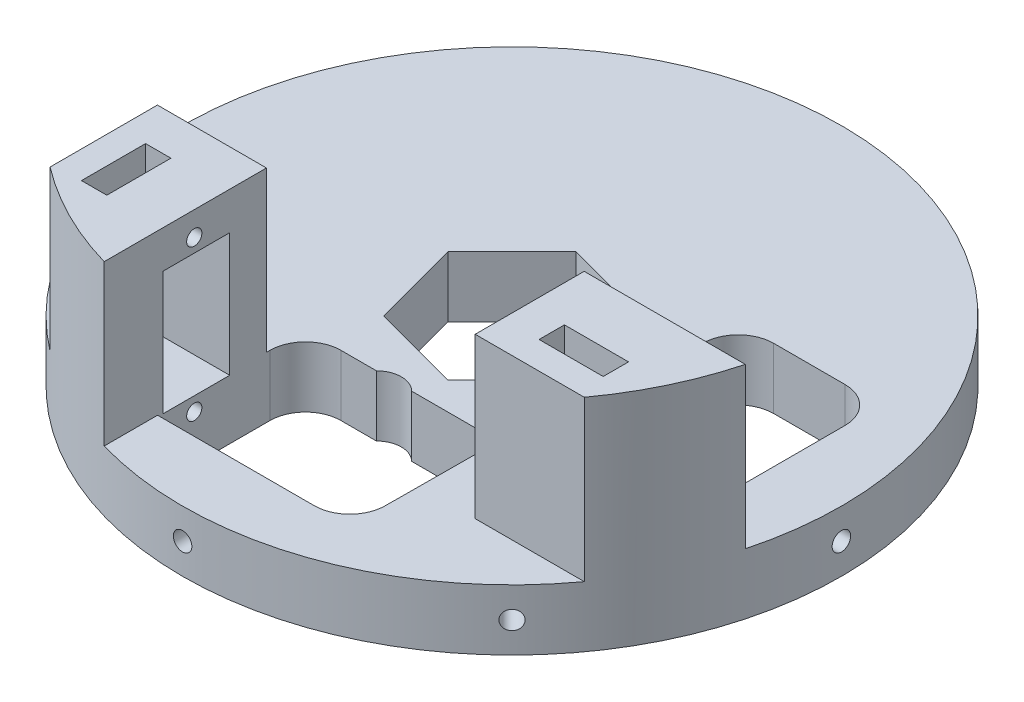
from build123d import *
from build123d.topology import SkipClean

# Parameters (mm, degrees)
BOSS_EXTRUDE1_DEPTH   = 12
BOSS_EXTRUDE1_2_DEPTH = 12
BOSS_EXTRUDE2_DEPTH   = 43.5
SKETCH9_W             = 16.09
SKETCH9_H             = 12.33
BOSS_EXTRUDE3_DEPTH   = 12.5
SKETCH10_W            = 12.33
SKETCH10_H            = 16.09
BOSS_EXTRUDE4_DEPTH   = 12.5
BOSS_EXTRUDE5_START   = 22.85
SKETCH11_W            = 12.33
SKETCH11_H            = 16.09
SKETCH11_W_2          = 16.09
SKETCH11_H_2          = 12.33
BOSS_EXTRUDE5_DEPTH   = 8.15
SKETCH21_W            = 34.892896775
SKETCH21_H            = 3.983406167
SKETCH21_W_2          = 3.397806166
SKETCH21_H_2          = 35.53848689
BOSS_EXTRUDE8_DEPTH   = 12
SKETCH13_W            = 0.82460559
SKETCH13_H            = 22.85
CUT_EXTRUDE1_DEPTH    = 16.09
SKETCH14_W            = 0.915845165
SKETCH14_H            = 22.85
CUT_EXTRUDE2_DEPTH    = 16.09
SKETCH15_W            = 2.3
SKETCH15_H            = 12
BOSS_EXTRUDE6_DEPTH   = 39.09
SKETCH16_W            = 3.5
SKETCH16_H            = 12
BOSS_EXTRUDE7_DEPTH   = 39.09
SKETCH17_W            = 10.950625106
SKETCH17_H            = 21.5
SKETCH17_W_2          = 21.501773634
SKETCH17_H_2          = 11.67953826
CUT_EXTRUDE3_DEPTH    = 31.5
CUT_EXTRUDE4_START    = 65
SKETCH18_R            = 1.825
CUT_EXTRUDE4_DEPTH    = 11
CIRPATTERN1_COUNT     = 8
SKETCH19_R            = 1.5
CUT_EXTRUDE5_DEPTH    = 5
SKETCH20_R            = 1.5
CUT_EXTRUDE8_DEPTH    = 5
SKETCH22_W            = 5
SKETCH22_H            = 12.65
SKETCH22_W_2          = 12.65
SKETCH22_H_2          = 5
CUT_EXTRUDE9_DEPTH    = 12
FILLET1_R             = 7
CUT_EXTRUDE10_DEPTH   = 12
CUT_EXTRUDE11_DEPTH   = 12
SKETCH25_W            = 13.245845165
SKETCH25_H            = 0.617327952
SKETCH25_H_2          = 0.5
CUT_EXTRUDE12_DEPTH   = 16.09
SKETCH26_W            = 13.15460559
SKETCH26_H            = 0.716542238
SKETCH26_H_2          = 0.793164057
CUT_EXTRUDE13_DEPTH   = 16.09


with BuildPart() as part:
    # Sketch8 → Boss-Extrude1 (new body)
    with BuildSketch(Plane(origin=(0, 0, 0), x_dir=(1, 0, 0), z_dir=(0, 1, 0))):
        with BuildLine():
            Line((-39.48619564, -18.776596206), (-17.984422006, -18.776596206))
            Line((-17.984422006, -18.776596206), (-17.984422006, -18.772777241))
            Line((-17.984422006, -18.772777241), (12.857426144, -18.772777241))
            Line((12.857426144, -18.772777241), (20.062824101, -25.857862934))
            Line((20.062824101, -25.857862934), (20.062824101, -16.775))
            Line((20.062824101, -16.775), (25.897828719, -16.775))
            Line((25.897828719, -16.775), (20.099516291, -11.073504999))
            Line((20.099516291, -11.073504999), (20.099516291, 21.123910655))
            Line((20.099516291, 21.123910655), (53.873878262, 21.123910655))
            Line((53.873878262, 21.123910655), (53.873878262, -16.775))
            Line((53.873878262, -16.775), (62.798084167, -16.775))
            ThreePointArc((62.798084167, -16.775), (-20.966872805, 61.525525148), (-39.48619564, -51.63177659))
            Line((-39.48619564, -51.63177659), (-39.48619564, -18.776596206))
        make_face()
        Polygon((12.655697004, 12.655697004), (17.288003611, -4.632306606), (4.632306606, -17.288003611), (-12.655697004, -12.655697004), (-17.288003611, 4.632306606), (-4.632306606, 17.288003611), align=None, mode=Mode.SUBTRACT)
    extrude(amount=BOSS_EXTRUDE1_DEPTH)



with BuildPart() as body_2:
    # Sketch8 → Boss-Extrude1 2 (new body)
    with BuildSketch(Plane(origin=(0, 0, 0), x_dir=(1, 0, 0), z_dir=(0, 1, 0))):
        with BuildLine():
            Line((-17.984422006, -55.432543879), (-17.984422006, -62.462473255))
            ThreePointArc((-17.984422006, -62.462473255), (21.088153384, -61.484061242), (52.535934131, -38.275))
            Line((52.535934131, -38.275), (20.062824101, -38.275))
            Line((20.062824101, -38.275), (20.062824101, -25.857862934))
            Line((20.062824101, -25.857862934), (19.864525542, -55.432543879))
            Line((19.864525542, -55.432543879), (-17.984422006, -55.432543879))
        make_face()
    extrude(amount=BOSS_EXTRUDE1_2_DEPTH)


with BuildPart() as part_1:
    add(part.part)

    add(body_2.part)  # Boss-Extrude2 merges body 2
    # Sketch8<4> → Boss-Extrude2 (add)
    with BuildSketch(Plane(origin=(0, 0, 0), x_dir=(1, 0, 0), z_dir=(0, 1, 0))):
        with BuildLine():
            Line((-34.074422006, -38.525), (-17.984422006, -38.525))
            Line((-17.984422006, -38.525), (-17.984422006, -18.776596206))
            Line((-17.984422006, -18.776596206), (-39.48619564, -18.776596206))
            Line((-39.48619564, -18.776596206), (-39.48619564, -51.63177659))
            ThreePointArc((-39.48619564, -51.63177659), (-29.241134908, -58.051322373), (-17.984422006, -62.462473255))
            Line((-17.984422006, -62.462473255), (-17.984422006, -50.855))
            Line((-17.984422006, -50.855), (-34.074422006, -50.855))
            Line((-34.074422006, -50.855), (-34.074422006, -38.525))
        make_face()
        with BuildLine():
            Line((20.062824101, -16.775), (20.062824101, -38.275))
            Line((20.062824101, -38.275), (52.535934131, -38.275))
            ThreePointArc((52.535934131, -38.275), (58.660433379, -27.999170628), (62.798084167, -16.775))
            Line((62.798084167, -16.775), (50.855, -16.775))
            Line((50.855, -16.775), (50.855, -32.865))
            Line((50.855, -32.865), (38.525, -32.865))
            Line((38.525, -32.865), (38.525, -16.775))
            Line((38.525, -16.775), (20.062824101, -16.775))
        make_face()
    extrude(amount=BOSS_EXTRUDE2_DEPTH)

    # Sketch9 → Boss-Extrude3 (add)
    with BuildSketch(Plane.XZ):
        with Locations((-26.029422006, 44.69)):
            Rectangle(SKETCH9_W, SKETCH9_H)
    extrude(amount=-BOSS_EXTRUDE3_DEPTH)

    # Sketch10 → Boss-Extrude4 (add)
    with BuildSketch(Plane.XZ):
        with Locations((44.69, 24.82)):
            Rectangle(SKETCH10_W, SKETCH10_H)
    extrude(amount=-BOSS_EXTRUDE4_DEPTH)

    # Sketch11 → Boss-Extrude5 (add)
    with BuildSketch(Plane(origin=(0, 12.5, 0), x_dir=(1, 0, 0), z_dir=(0, 1, 0)).offset(BOSS_EXTRUDE5_START)):
        with Locations((44.69, -24.82)):
            Rectangle(SKETCH11_W, SKETCH11_H)
        with Locations((-26.029422006, -44.69)):
            Rectangle(SKETCH11_W_2, SKETCH11_H_2)
    extrude(amount=BOSS_EXTRUDE5_DEPTH)

    # Sketch21 → Boss-Extrude8 (add)
    with BuildSketch(Plane(origin=(0, 12, 0), x_dir=(1, 0, 0), z_dir=(0, 1, 0))):
        with Locations((-0.537973619, -20.764480324)):
            Rectangle(SKETCH21_W, SKETCH21_H)
        with Locations((21.798419374, 3.35466721)):
            Rectangle(SKETCH21_W_2, SKETCH21_H_2)
    extrude(amount=-BOSS_EXTRUDE8_DEPTH)

    # Sketch13 → Cut-Extrude1 (cut)
    with BuildSketch(Plane(origin=(-17.984422006, 0, 0), x_dir=(0, 0, -1), z_dir=(1, 0, 0))):
        with Locations((-38.112697205, 23.925)):
            Rectangle(SKETCH13_W, SKETCH13_H)
    extrude(amount=-CUT_EXTRUDE1_DEPTH, mode=Mode.SUBTRACT)

    # Sketch14 → Cut-Extrude2 (cut)
    with BuildSketch(Plane(origin=(0, 0, 16.775), x_dir=(-1, 0, 0), z_dir=(0, 0, -1))):
        with Locations((-38.067077418, 23.925)):
            Rectangle(SKETCH14_W, SKETCH14_H)
    extrude(amount=-CUT_EXTRUDE2_DEPTH, mode=Mode.SUBTRACT)

    # Sketch15 → Boss-Extrude6 (add)
    with BuildSketch(Plane(origin=(0, 0, 16.775), x_dir=(-1, 0, 0), z_dir=(0, 0, -1))):
        with Locations((-52.723878262, 6)):
            Rectangle(SKETCH15_W, SKETCH15_H)
    extrude(amount=BOSS_EXTRUDE6_DEPTH)

    # Sketch16 → Boss-Extrude7 (add)
    with BuildSketch(Plane(origin=(-17.984422006, 0, 0), x_dir=(0, 0, -1), z_dir=(1, 0, 0))):
        with Locations((-53.682543879, 6)):
            Rectangle(SKETCH16_W, SKETCH16_H)
    extrude(amount=BOSS_EXTRUDE7_DEPTH)

    # Sketch17 → Cut-Extrude3 (cut)
    with BuildSketch(Plane(origin=(0, 43.5, 0), x_dir=(1, 0, 0), z_dir=(0, 1, 0))):
        with Locations((25.538136654, -27.525)):
            Rectangle(SKETCH17_W, SKETCH17_H)
        with Locations((-28.735308823, -24.616365336)):
            Rectangle(SKETCH17_W_2, SKETCH17_H_2)
    extrude(amount=-CUT_EXTRUDE3_DEPTH, mode=Mode.SUBTRACT)

    # Sketch18 → Cut-Extrude4 (cut)
    with SkipClean():  # the faces are left unmerged after this step: merging them gives an invalid solid
        with BuildSketch(Plane.XY.offset(CUT_EXTRUDE4_START)):
            with Locations((0, 6)):
                Circle(SKETCH18_R)
        cut_extrude4 = extrude(amount=-CUT_EXTRUDE4_DEPTH, mode=Mode.SUBTRACT)

    # CirPattern1: Cut-Extrude4 ×8 about axis
    with SkipClean():  # the faces are left unmerged after this step: merging them gives an invalid solid
        cirpattern1_axis = Axis((0, 12, 0), (0, -1, 0))
        for i in range(1, CIRPATTERN1_COUNT):
            add(cut_extrude4.rotate(cirpattern1_axis, i * 360 / CIRPATTERN1_COUNT), mode=Mode.SUBTRACT)

    # Sketch19 → Cut-Extrude5 (cut)
    with SkipClean():  # the faces are left unmerged after this step: merging them gives an invalid solid
        with BuildSketch(Plane(origin=(0, 0, 16.775), x_dir=(-1, 0, 0), z_dir=(0, 0, -1))):
            with Locations((-44.69, 38.75)):
                Circle(SKETCH19_R)
            with Locations((-44.69, 8.95)):
                Circle(SKETCH19_R)
        extrude(amount=-CUT_EXTRUDE5_DEPTH, mode=Mode.SUBTRACT)

    # Sketch20 → Cut-Extrude8 (cut)
    with SkipClean():  # the faces are left unmerged after this step: merging them gives an invalid solid
        with BuildSketch(Plane(origin=(-17.984422006, 0, 0), x_dir=(0, 0, -1), z_dir=(1, 0, 0))):
            with Locations((-44.69, 38.75)):
                Circle(SKETCH20_R)
            with Locations((-44.69, 8.95)):
                Circle(SKETCH20_R)
        extrude(amount=-CUT_EXTRUDE8_DEPTH, mode=Mode.SUBTRACT)

    # Sketch22 → Cut-Extrude9 (cut)
    with SkipClean():  # the faces are left unmerged after this step: merging them gives an invalid solid
        with BuildSketch(Plane(origin=(0, 43.5, 0), x_dir=(1, 0, 0), z_dir=(0, 1, 0))):
            with Locations((-31.574422006, -44.53)):
                Rectangle(SKETCH22_W, SKETCH22_H)
            with Locations((44.53, -30.365)):
                Rectangle(SKETCH22_W_2, SKETCH22_H_2)
        extrude(amount=-CUT_EXTRUDE9_DEPTH, mode=Mode.SUBTRACT)

    # Fillet1
    fillet1_edges = [part_1.edges().sort_by_distance(p)[0] for p in [
        (51.573878262, 6, -21.123910655),
        (19.88799308, 6, 51.932543879),
        (-17.984422006, 6, 22.756183408),
        (23.497322457, 6, -21.123910655),
    ]]
    fillet(fillet1_edges, radius=FILLET1_R)

    # Sketch23 → Cut-Extrude10 (cut)
    with SkipClean():  # the faces are left unmerged after this step: merging them gives an invalid solid
        with BuildSketch(Plane(origin=(0, 12, 0), x_dir=(1, 0, 0), z_dir=(0, 1, 0))):
            with BuildLine():
                Line((-3.988594308, -22.756183408), (2.962026381, -22.756183408))
                ThreePointArc((2.962026381, -22.756183408), (-0.513283963, -21.31666273), (-3.988594308, -22.756183408))
            make_face()
        extrude(amount=-CUT_EXTRUDE10_DEPTH, mode=Mode.SUBTRACT)

    # Sketch24 → Cut-Extrude11 (cut)
    with SkipClean():  # the faces are left unmerged after this step: merging them gives an invalid solid
        with BuildSketch(Plane(origin=(0, 12, 0), x_dir=(1, 0, 0), z_dir=(0, 1, 0))):
            with BuildLine():
                Line((23.497322457, -3.301623153), (23.497322457, 3.156615754))
                ThreePointArc((23.497322457, 3.156615754), (22.159777385, -0.072503699), (23.497322457, -3.301623153))
            make_face()
        extrude(amount=-CUT_EXTRUDE11_DEPTH, mode=Mode.SUBTRACT)

    # Sketch25 → Cut-Extrude12 (cut)
    with SkipClean():  # the faces are left unmerged after this step: merging them gives an invalid solid
        with BuildSketch(Plane(origin=(0, 0, 16.775), x_dir=(-1, 0, 0), z_dir=(0, 0, -1))):
            with Locations((-44.232077418, 35.658663976)):
                Rectangle(SKETCH25_W, SKETCH25_H)
            with Locations((-44.232077418, 12.25)):
                Rectangle(SKETCH25_W, SKETCH25_H_2)
        extrude(amount=-CUT_EXTRUDE12_DEPTH, mode=Mode.SUBTRACT)

    # Sketch26 → Cut-Extrude13 (cut)
    with SkipClean():  # the faces are left unmerged after this step: merging them gives an invalid solid
        with BuildSketch(Plane(origin=(-17.984422006, 0, 0), x_dir=(0, 0, -1), z_dir=(1, 0, 0))):
            with Locations((-44.277697205, 35.708271119)):
                Rectangle(SKETCH26_W, SKETCH26_H)
            with Locations((-44.277697205, 12.103417972)):
                Rectangle(SKETCH26_W, SKETCH26_H_2)
        extrude(amount=-CUT_EXTRUDE13_DEPTH, mode=Mode.SUBTRACT)


solid = part_1.part
